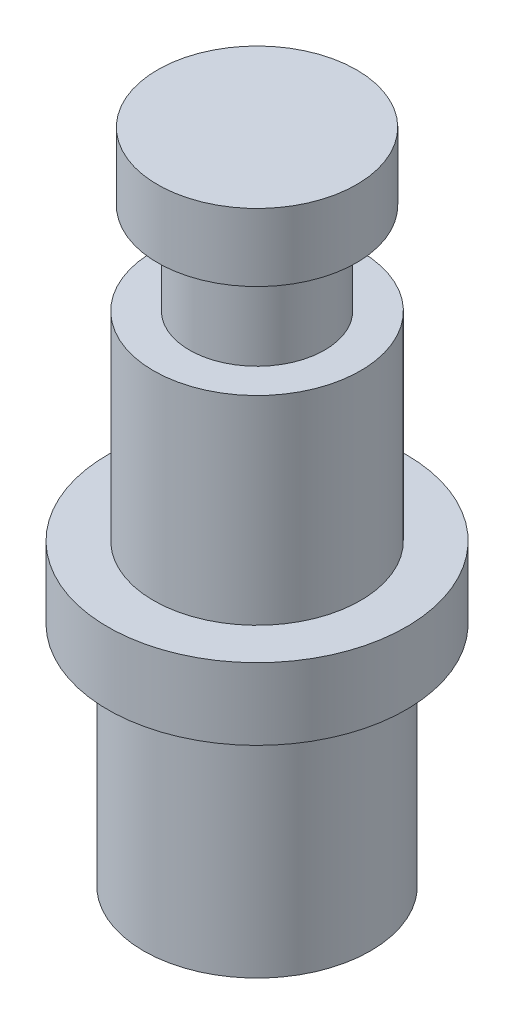
from build123d import *


with BuildPart() as part:
    # Sketch2 → Revolve1 (revolve)
    with BuildSketch(Plane.XY, mode=Mode.PRIVATE) as revolve1_sk:
        Polygon((0, 0), (3.6195, 0), (3.6195, 7.239), (4.7625, 7.239), (4.7625, 9.525), (3.302, 9.525), (3.302, 15.875), (2.159, 15.875), (2.159, 18.796), (3.175, 18.796), (3.175, 20.955), (0, 20.955), align=None)
    revolve(revolve1_sk.sketch.rotate(Axis((0, 0, 0), (0, 1, 0)), 90), axis=Axis((0, 0, 0), (0, 1, 0)))


solid = part.part
